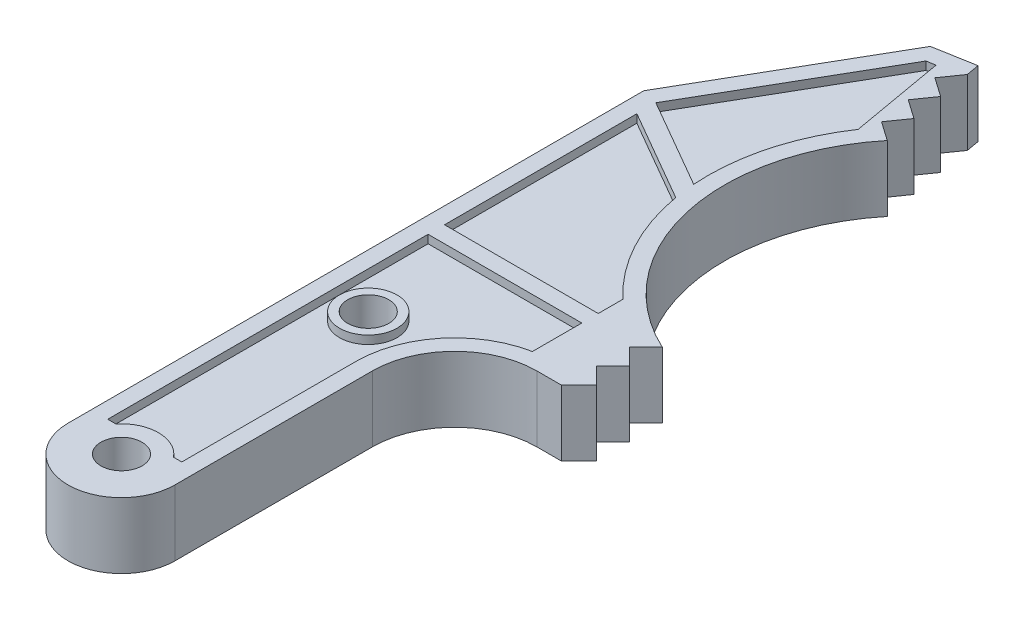
from build123d import *

# Parameters (mm, degrees)
CROQUIS2_R              = 2.5
SALIENTE_EXTRUIR1_DEPTH = 8
CROQUIS3_R              = 3.5
CORTAR_EXTRUIR1_DEPTH   = 1
CORTAR_EXTRUIR2_START   = -1
CROQUIS4_R              = 3.5
CORTAR_EXTRUIR2_DEPTH   = 1


with BuildPart() as part:
    # Croquis2 → Saliente-Extruir1 (new body)
    with BuildSketch(Plane(origin=(0, 0, 0), x_dir=(1, 0, 0), z_dir=(0, 1, 0))):
        with BuildLine():
            Line((-6.5, 70), (-6.5, 0))
            ThreePointArc((-6.5, 0), (0, -6.5), (6.5, 0))
            Line((6.5, 0), (6.5, 24))
            ThreePointArc((6.5, 24), (9.428932188, 31.071067812), (16.5, 34))
            Line((16.5, 34), (19.5, 34))
            Line((19.5, 34), (21.621320344, 36.121320344))
            Line((21.621320344, 36.121320344), (19.621320344, 38.121320344))
            Line((19.621320344, 38.121320344), (21.621320344, 40.121320344))
            Line((21.621320344, 40.121320344), (19.621320344, 42.121320344))
            Line((19.621320344, 42.121320344), (21.621320344, 44.121320344))
            ThreePointArc((21.621320344, 44.121320344), (8.897927721, 59.859277281), (13.535653981, 79.558503244))
            Line((13.535653981, 79.558503244), (11.21874212, 81.180822395))
            Line((11.21874212, 81.180822395), (12.841061271, 83.497734256))
            Line((12.841061271, 83.497734256), (10.524149409, 85.120053407))
            Line((10.524149409, 85.120053407), (12.14646856, 87.436965268))
            Line((12.14646856, 87.436965268), (9.829556699, 89.059284419))
            Line((9.829556699, 89.059284419), (11.451875849, 91.37619628))
            Line((11.451875849, 91.37619628), (11.174038765, 92.951888685))
            Line((11.174038765, 92.951888685), (6.25, 92.083647797))
            Line((6.25, 92.083647797), (-6.5, 70))
        make_face()
        with Locations(Location((0, 0, 0), (0, 0, 270))):
            Circle(CROQUIS2_R, mode=Mode.SUBTRACT)
        with Locations(Location((0, 30, 0), (0, 0, 270))):
            Circle(CROQUIS2_R, mode=Mode.SUBTRACT)
    extrude(amount=SALIENTE_EXTRUIR1_DEPTH)

    # Croquis3 → Cortar-Extruir1 (cut)
    # profile 1 of 3: a face of its own
    with BuildSketch(Plane(origin=(0, 8, 0), x_dir=(1, 0, 0), z_dir=(0, 1, 0))):
        with BuildLine():
            Line((7.515743149, 90.275979241), (-4.5, 69.464101615))
            Line((-4.5, 69.464101615), (6.386283079, 63.178903149))
            ThreePointArc((6.386283079, 63.178903149), (7.166644063, 71.420557609), (10.59569924, 78.955503667))
            Line((10.59569924, 78.955503667), (8.566911861, 90.461328646))
            Line((8.566911861, 90.461328646), (7.515743149, 90.275979241))
        make_face()
    # profile 2 of 3: a face of its own
    with BuildSketch(Plane(origin=(0, 8, 0), x_dir=(1, 0, 0), z_dir=(0, 1, 0))):
        with BuildLine():
            Line((-4.5, 67.154700538), (-4.5, 43.774315056))
            Line((-4.5, 43.774315056), (14.183644035, 43.774315056))
            Line((14.183644035, 43.774315056), (14.183644035, 46.774315056))
            ThreePointArc((14.183644035, 46.774315056), (9.308263877, 53.126130169), (6.691099089, 60.693516467))
            Line((6.691099089, 60.693516467), (-4.5, 67.154700538))
        make_face()
    # profile 3 of 3: a face of its own
    with BuildSketch(Plane(origin=(0, 8, 0), x_dir=(1, 0, 0), z_dir=(0, 1, 0))):
        with BuildLine():
            Line((-4.5, 2.828427125), (-4.5, 41.774315056))
            Line((-4.5, 41.774315056), (14.183644035, 41.774315056))
            Line((14.183644035, 41.774315056), (14.183644035, 35.774315056))
            ThreePointArc((14.183644035, 35.774315056), (7.231875282, 31.622457885), (4.5, 24))
            Line((4.5, 24), (4.5, 2.828427125))
            Line((4.5, 2.828427125), (3.5, 2.828427125))
            ThreePointArc((3.5, 2.828427125), (0, 4.5), (-3.5, 2.828427125))
            Line((-3.5, 2.828427125), (-4.5, 2.828427125))
        make_face()
        with Locations(Location((0, 30, 0), (0, 0, 270))):
            Circle(CROQUIS3_R, mode=Mode.SUBTRACT)
    extrude(amount=-CORTAR_EXTRUIR1_DEPTH, mode=Mode.SUBTRACT)

    # Croquis4 → Cortar-Extruir2 (cut)
    # profile 1 of 3: a face of its own
    with BuildSketch(Plane.XZ.offset(CORTAR_EXTRUIR2_START)):
        with BuildLine():
            Line((4.5, -24), (4.5, -2.828427125))
            Line((4.5, -2.828427125), (3.5, -2.828427125))
            ThreePointArc((3.5, -2.828427125), (0, -4.5), (-3.5, -2.828427125))
            Line((-3.5, -2.828427125), (-4.5, -2.828427125))
            Line((-4.5, -2.828427125), (-4.5, -41.774315056))
            Line((-4.5, -41.774315056), (14.183644035, -41.774315056))
            Line((14.183644035, -41.774315056), (14.183644035, -35.774315056))
            ThreePointArc((14.183644035, -35.774315056), (7.231875282, -31.622457885), (4.5, -24))
        make_face()
        with Locations(Location((0, -30, 0), (0, 0, 90))):
            Circle(CROQUIS4_R, mode=Mode.SUBTRACT)
    # profile 2 of 3: a face of its own
    with BuildSketch(Plane.XZ.offset(CORTAR_EXTRUIR2_START)):
        with BuildLine():
            Line((6.386283079, -63.178903149), (-4.5, -69.464101615))
            Line((-4.5, -69.464101615), (7.515743149, -90.275979241))
            Line((7.515743149, -90.275979241), (8.566911861, -90.461328646))
            Line((8.566911861, -90.461328646), (10.59569924, -78.955503667))
            ThreePointArc((10.59569924, -78.955503667), (7.166644063, -71.420557609), (6.386283079, -63.178903149))
        make_face()
    # profile 3 of 3: a face of its own
    with BuildSketch(Plane.XZ.offset(CORTAR_EXTRUIR2_START)):
        with BuildLine():
            Line((-4.5, -67.154700538), (6.691099089, -60.693516467))
            ThreePointArc((6.691099089, -60.693516467), (9.308263877, -53.126130169), (14.183644035, -46.774315056))
            Line((14.183644035, -46.774315056), (14.183644035, -43.774315056))
            Line((14.183644035, -43.774315056), (-4.5, -43.774315056))
            Line((-4.5, -43.774315056), (-4.5, -67.154700538))
        make_face()
    extrude(amount=CORTAR_EXTRUIR2_DEPTH, mode=Mode.SUBTRACT)


solid = part.part
